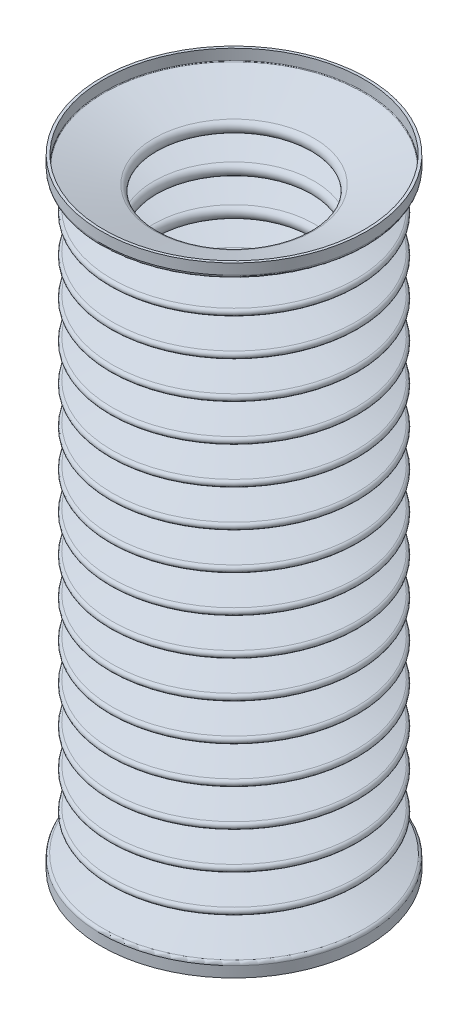
from build123d import *

# Parameters (mm, degrees)
SHELL1_T = -1.1938


with BuildPart() as part:
    # Sketch1 → Revolve2 (revolve)
    with BuildSketch(Plane.XY):
        with BuildLine():
            Line((0, 0), (0, 279.4))
            Line((0, 279.4), (59.944, 279.4))
            Line((59.944, 279.4), (59.944, 274.571655851))
            ThreePointArc((59.944, 274.571655851), (59.640100226, 273.658457385), (58.849601787, 273.109459454))
            Line((58.849601787, 273.109459454), (36.472744433, 266.535008897))
            ThreePointArc((36.472744433, 266.535008897), (35.37834622, 265.0728125), (36.472744433, 263.610616103))
            Line((36.472744433, 263.610616103), (54.967255567, 258.176821397))
            ThreePointArc((54.967255567, 258.176821397), (56.06165378, 256.714625), (54.967255567, 255.252428603))
            Line((54.967255567, 255.252428603), (36.472744433, 249.818633897))
            ThreePointArc((36.472744433, 249.818633897), (35.37834622, 248.3564375), (36.472744433, 246.894241103))
            Line((36.472744433, 246.894241103), (54.967255567, 241.460446397))
            ThreePointArc((54.967255567, 241.460446397), (56.06165378, 239.99825), (54.967255567, 238.536053603))
            Line((54.967255567, 238.536053603), (36.472744433, 233.102258897))
            ThreePointArc((36.472744433, 233.102258897), (35.37834622, 231.6400625), (36.472744433, 230.177866103))
            Line((36.472744433, 230.177866103), (54.967255567, 224.744071397))
            ThreePointArc((54.967255567, 224.744071397), (56.06165378, 223.281875), (54.967255567, 221.819678603))
            Line((54.967255567, 221.819678603), (36.472744433, 216.385883897))
            ThreePointArc((36.472744433, 216.385883897), (35.37834622, 214.9236875), (36.472744433, 213.461491103))
            Line((36.472744433, 213.461491103), (54.967255567, 208.027696397))
            ThreePointArc((54.967255567, 208.027696397), (56.06165378, 206.5655), (54.967255567, 205.103303603))
            Line((54.967255567, 205.103303603), (36.472744433, 199.669508897))
            ThreePointArc((36.472744433, 199.669508897), (35.37834622, 198.2073125), (36.472744433, 196.745116103))
            Line((36.472744433, 196.745116103), (54.967255567, 191.311321397))
            ThreePointArc((54.967255567, 191.311321397), (56.06165378, 189.849125), (54.967255567, 188.386928603))
            Line((54.967255567, 188.386928603), (36.472744433, 182.953133897))
            ThreePointArc((36.472744433, 182.953133897), (35.37834622, 181.4909375), (36.472744433, 180.028741103))
            Line((36.472744433, 180.028741103), (54.967255567, 174.594946397))
            ThreePointArc((54.967255567, 174.594946397), (56.06165378, 173.13275), (54.967255567, 171.670553603))
            Line((54.967255567, 171.670553603), (36.472744433, 166.236758897))
            ThreePointArc((36.472744433, 166.236758897), (35.37834622, 164.7745625), (36.472744433, 163.312366103))
            Line((36.472744433, 163.312366103), (54.967255567, 157.878571397))
            ThreePointArc((54.967255567, 157.878571397), (56.06165378, 156.416375), (54.967255567, 154.954178603))
            Line((54.967255567, 154.954178603), (36.472744433, 149.520383897))
            ThreePointArc((36.472744433, 149.520383897), (35.37834622, 148.0581875), (36.472744433, 146.595991103))
            Line((36.472744433, 146.595991103), (54.967255567, 141.162196397))
            ThreePointArc((54.967255567, 141.162196397), (56.06165378, 139.7), (54.967255567, 138.237803603))
            Line((54.967255567, 138.237803603), (36.472744433, 132.804008897))
            ThreePointArc((36.472744433, 132.804008897), (35.37834622, 131.3418125), (36.472744433, 129.879616103))
            Line((36.472744433, 129.879616103), (54.967255567, 124.445821397))
            ThreePointArc((54.967255567, 124.445821397), (56.06165378, 122.983625), (54.967255567, 121.521428603))
            Line((54.967255567, 121.521428603), (36.472744433, 116.087633897))
            ThreePointArc((36.472744433, 116.087633897), (35.37834622, 114.6254375), (36.472744433, 113.163241103))
            Line((36.472744433, 113.163241103), (54.967255567, 107.729446397))
            ThreePointArc((54.967255567, 107.729446397), (56.06165378, 106.26725), (54.967255567, 104.805053603))
            Line((54.967255567, 104.805053603), (36.472744433, 99.371258897))
            ThreePointArc((36.472744433, 99.371258897), (35.37834622, 97.9090625), (36.472744433, 96.446866103))
            Line((36.472744433, 96.446866103), (54.967255567, 91.013071397))
            ThreePointArc((54.967255567, 91.013071397), (56.06165378, 89.550875), (54.967255567, 88.088678603))
            Line((54.967255567, 88.088678603), (36.472744433, 82.654883897))
            ThreePointArc((36.472744433, 82.654883897), (35.37834622, 81.1926875), (36.472744433, 79.730491103))
            Line((36.472744433, 79.730491103), (54.967255567, 74.296696397))
            ThreePointArc((54.967255567, 74.296696397), (56.06165378, 72.8345), (54.967255567, 71.372303603))
            Line((54.967255567, 71.372303603), (36.472744433, 65.938508897))
            ThreePointArc((36.472744433, 65.938508897), (35.37834622, 64.4763125), (36.472744433, 63.014116103))
            Line((36.472744433, 63.014116103), (54.967255567, 57.580321397))
            ThreePointArc((54.967255567, 57.580321397), (56.06165378, 56.118125), (54.967255567, 54.655928603))
            Line((54.967255567, 54.655928603), (36.472744433, 49.222133897))
            ThreePointArc((36.472744433, 49.222133897), (35.37834622, 47.7599375), (36.472744433, 46.297741103))
            Line((36.472744433, 46.297741103), (54.967255567, 40.863946397))
            ThreePointArc((54.967255567, 40.863946397), (56.06165378, 39.40175), (54.967255567, 37.939553603))
            Line((54.967255567, 37.939553603), (36.472744433, 32.505758897))
            ThreePointArc((36.472744433, 32.505758897), (35.37834622, 31.0435625), (36.472744433, 29.581366103))
            Line((36.472744433, 29.581366103), (54.967255567, 24.147571397))
            ThreePointArc((54.967255567, 24.147571397), (56.06165378, 22.685375), (54.967255567, 21.223178603))
            Line((54.967255567, 21.223178603), (36.472744433, 15.789383897))
            ThreePointArc((36.472744433, 15.789383897), (35.37834622, 14.3271875), (36.472744433, 12.864991103))
            Line((36.472744433, 12.864991103), (58.849601787, 6.290540546))
            ThreePointArc((58.849601787, 6.290540546), (59.640100226, 5.741542615), (59.944, 4.828344149))
            Line((59.944, 4.828344149), (59.944, 0))
            Line((59.944, 0), (0, 0))
        make_face()
    revolve(axis=Axis((0, 0, 0), (0, 1, 0)))

    # Shell1
    shell1_openings = [part.faces().sort_by_distance(p)[0] for p in [
        (0, 0, 0),
        (0, 279.4, 0),
    ]]
    offset(amount=SHELL1_T, openings=shell1_openings, kind=Kind.INTERSECTION)


solid = part.part
